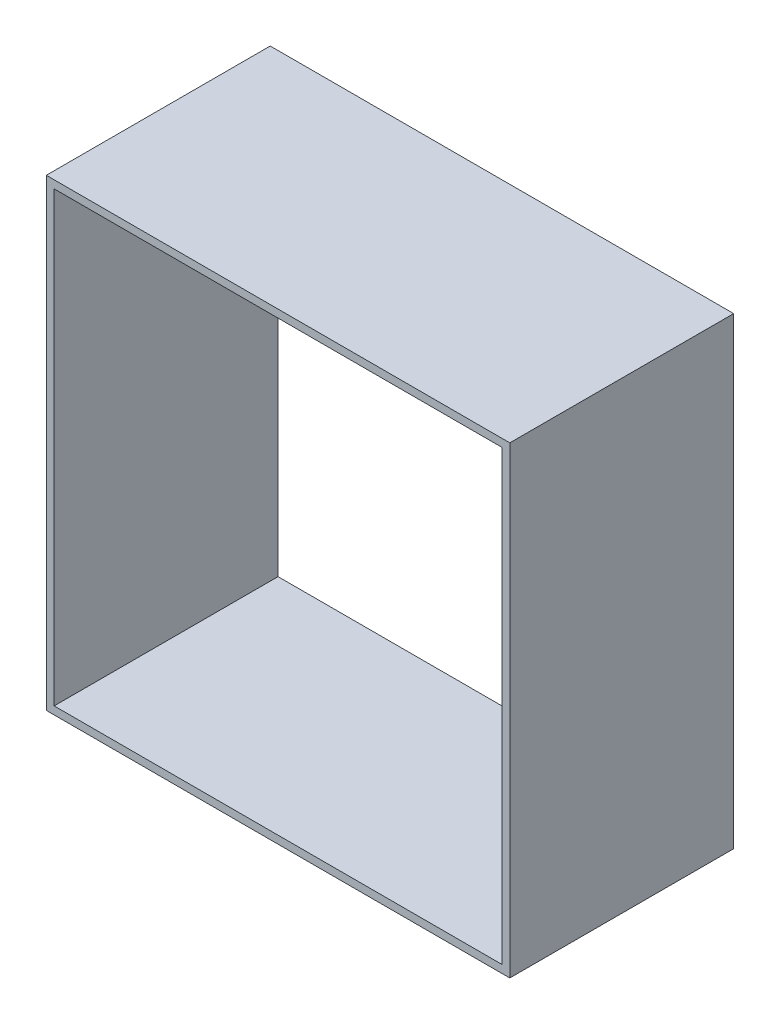
from build123d import *

# Parameters (mm, degrees)
SKETCH1_W           = 20.7
SKETCH1_H           = 20.7
SKETCH1_W_2         = 20
SKETCH1_H_2         = 20
BOSS_EXTRUDE1_DEPTH = 10


with BuildPart() as part:
    # Sketch1 → Boss-Extrude1 (new body)
    with BuildSketch(Plane.XY):
        Rectangle(SKETCH1_W, SKETCH1_H)
        Rectangle(SKETCH1_W_2, SKETCH1_H_2, mode=Mode.SUBTRACT)
    extrude(amount=BOSS_EXTRUDE1_DEPTH)


solid = part.part
